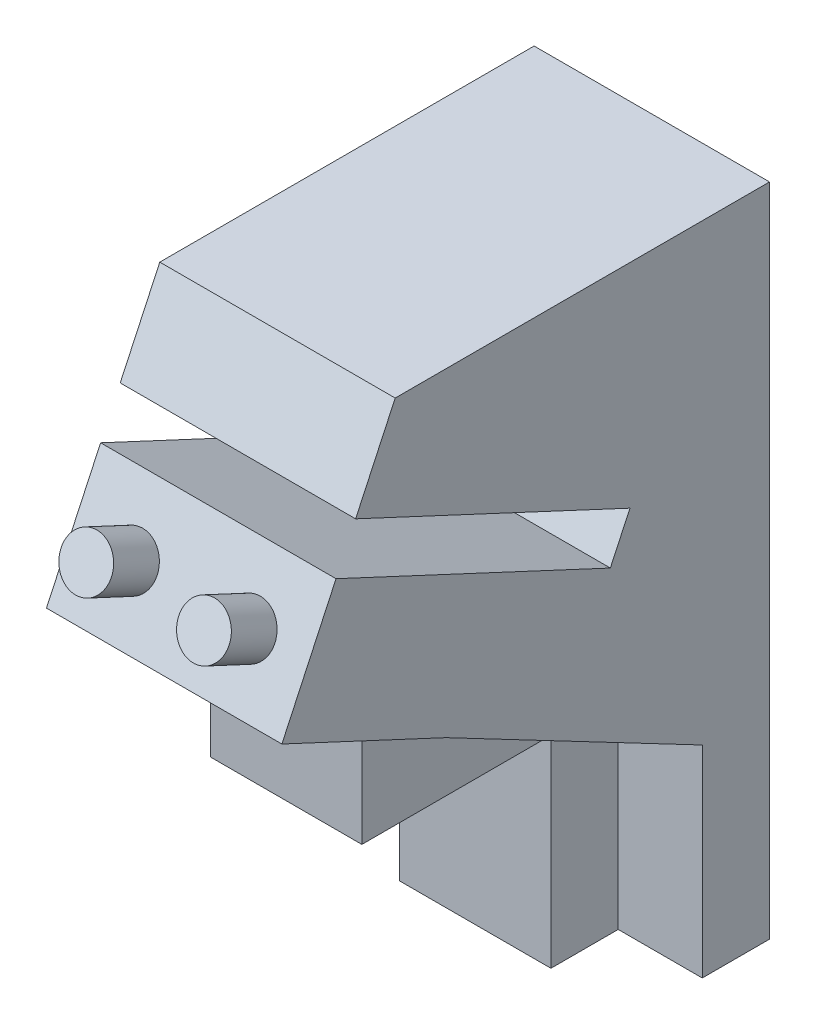
from build123d import *

# Parameters (mm, degrees)
BOSS_EXTRUDE1_DEPTH = 28
CUT_EXTRUDE1_START  = 28
CUT_EXTRUDE1_DEPTH  = 10
BOSS_EXTRUDE2_START = -10
SKETCH5_R           = 3
BOSS_EXTRUDE2_DEPTH = 6


with BuildPart() as part:
    # Sketch2 → Boss-Extrude1 (new body)
    with BuildSketch(Plane.YZ):
        Polygon((0, 0), (78, 0), (78, 44.523418625), (67.909286037, 49.228795822), (52.695028614, 16.601715489), (47.695028614, 18.933253779), (62.909286037, 51.560334113), (49.099377976, 58), (40, 38.486320959), (24, 38.486320959), (24, 16), (0, 16), (0, 8), align=None)
    extrude(amount=BOSS_EXTRUDE1_DEPTH)

    # Sketch3 → Cut-Extrude1 (cut)
    with BuildSketch(Plane.YZ.offset(CUT_EXTRUDE1_START)):
        Polygon((0, 8), (0, 16), (24, 16), (24, 38.486320959), (40, 38.486320959), (24, 8), align=None)
    extrude(amount=-CUT_EXTRUDE1_DEPTH, mode=Mode.SUBTRACT)

    # Sketch5 → Boss-Extrude2 (add)
    with BuildSketch(Plane(origin=(0, 35.210924553, 75.510071381), x_dir=(1, 0, 0), z_dir=(0, 0.42261826174070044, 0.9063077870366496)).offset(BOSS_EXTRUDE2_START)):
        with Locations(Location((7, 27.487289417, 0), (0, 0, 90))):
            Circle(SKETCH5_R)
        with Locations(Location((21, 27.487289417, 0), (0, 0, 90))):
            Circle(SKETCH5_R)
    extrude(amount=BOSS_EXTRUDE2_DEPTH)


solid = part.part
